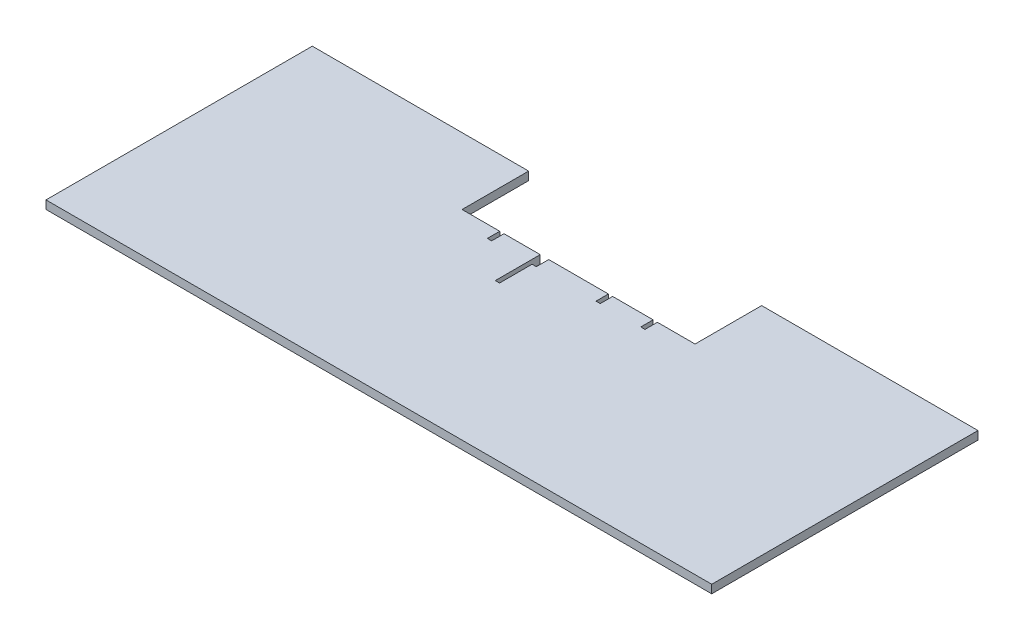
from build123d import *

# Parameters (mm, degrees)
BOSS_EXTRUDE1_DEPTH = 3.175
CUT_EXTRUDE1_REACH  = 275.585
SKETCH2_W           = 1.6256
SKETCH2_H           = 4.7244


with BuildPart() as part:
    # Sketch1 → Boss-Extrude1 (new body)
    with BuildSketch(Plane(origin=(0, 0, 0), x_dir=(1, 0, 0), z_dir=(0, 1, 0))):
        Polygon((171.45, 101.6), (254, 101.6), (254, 0), (0, 0), (0, 101.6), (82.55, 101.6), (82.55, 76.2), (171.45, 76.2), align=None)
    extrude(amount=BOSS_EXTRUDE1_DEPTH)

    # Sketch2 → Cut-Extrude1 (cut, up to next)
    with BuildSketch(Plane(origin=(0, 3.175, 0), x_dir=(-1, 0, 0), z_dir=(0, 1, 0)), mode=Mode.PRIVATE) as cut_extrude1_sk1:
        with Locations((-97.742468943, -73.8378)):
            Rectangle(SKETCH2_W, SKETCH2_H)
    cut_extrude1_tool1 = extrude(cut_extrude1_sk1.sketch, amount=-CUT_EXTRUDE1_REACH, mode=Mode.PRIVATE) & part.part
    # Sketch2 → Cut-Extrude1 (cut, up to next)
    with BuildSketch(Plane(origin=(0, 3.175, 0), x_dir=(-1, 0, 0), z_dir=(0, 1, 0)), mode=Mode.PRIVATE) as cut_extrude1_sk2:
        Polygon((-113.996008389, -76.2), (-115.621608389, -76.2), (-115.621608389, -71.4756), (-113.996008389, -71.4756), (-113.996008389, -59.055), (-112.370408389, -59.055), (-112.370408389, -76.2), align=None)
    cut_extrude1_tool2 = extrude(cut_extrude1_sk2.sketch, amount=-CUT_EXTRUDE1_REACH, mode=Mode.PRIVATE) & part.part
    # Sketch2 → Cut-Extrude1 (cut, up to next)
    with BuildSketch(Plane(origin=(0, 3.175, 0), x_dir=(-1, 0, 0), z_dir=(0, 1, 0)), mode=Mode.PRIVATE) as cut_extrude1_sk3:
        with Locations((-139.191191611, -73.8378)):
            Rectangle(SKETCH2_W, SKETCH2_H)
    cut_extrude1_tool3 = extrude(cut_extrude1_sk3.sketch, amount=-CUT_EXTRUDE1_REACH, mode=Mode.PRIVATE) & part.part
    # Sketch2 → Cut-Extrude1 (cut, up to next)
    with BuildSketch(Plane(origin=(0, 3.175, 0), x_dir=(-1, 0, 0), z_dir=(0, 1, 0)), mode=Mode.PRIVATE) as cut_extrude1_sk4:
        with Locations((-156.257531057, -73.8378)):
            Rectangle(SKETCH2_W, SKETCH2_H)
    cut_extrude1_tool4 = extrude(cut_extrude1_sk4.sketch, amount=-CUT_EXTRUDE1_REACH, mode=Mode.PRIVATE) & part.part
    add(cut_extrude1_tool1.solids().sort_by_distance((97.742469, 3.175, -73.8378))[0], mode=Mode.SUBTRACT)
    add(cut_extrude1_tool2.solids().sort_by_distance((113.534383, 3.175, -68.969098))[0], mode=Mode.SUBTRACT)
    add(cut_extrude1_tool3.solids().sort_by_distance((139.191192, 3.175, -73.8378))[0], mode=Mode.SUBTRACT)
    add(cut_extrude1_tool4.solids().sort_by_distance((156.257531, 3.175, -73.8378))[0], mode=Mode.SUBTRACT)


solid = part.part
